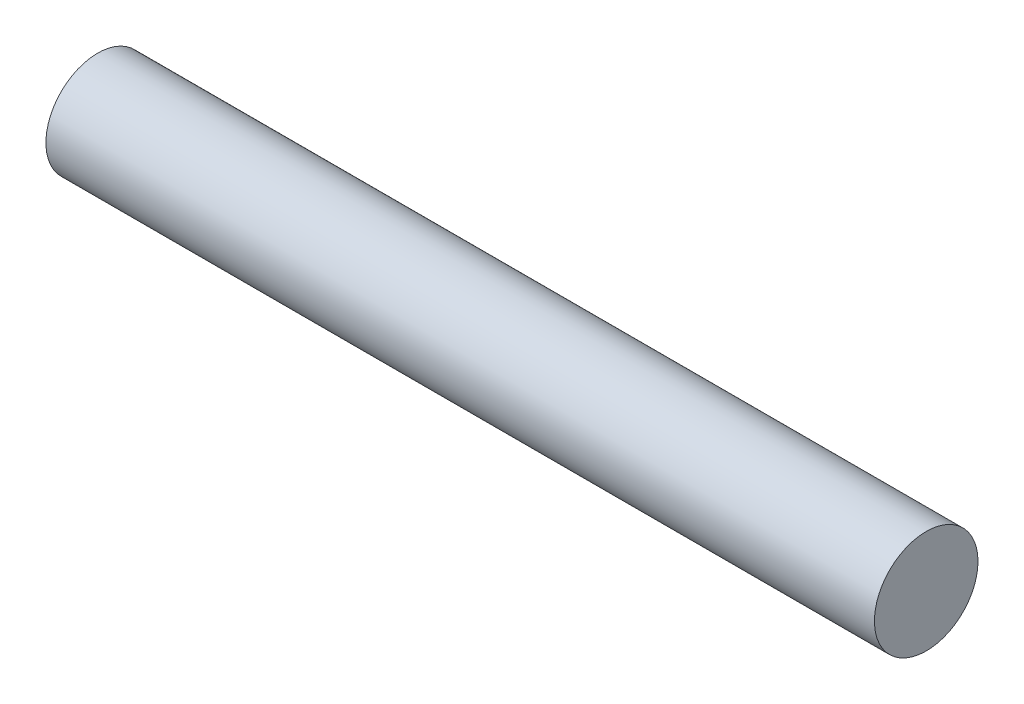
from build123d import *

# Parameters (mm, degrees)
SKETCH1_R           = 3.175
BOSS_EXTRUDE1_DEPTH = 25.4


with BuildPart() as part:
    # Sketch1 → Boss-Extrude1 (new, symmetric)
    with BuildSketch(Plane(origin=(0, 0, 0), x_dir=(0, 0, -1), z_dir=(1, 0, 0))):
        Circle(SKETCH1_R)
    extrude(amount=BOSS_EXTRUDE1_DEPTH, both=True)


solid = part.part
